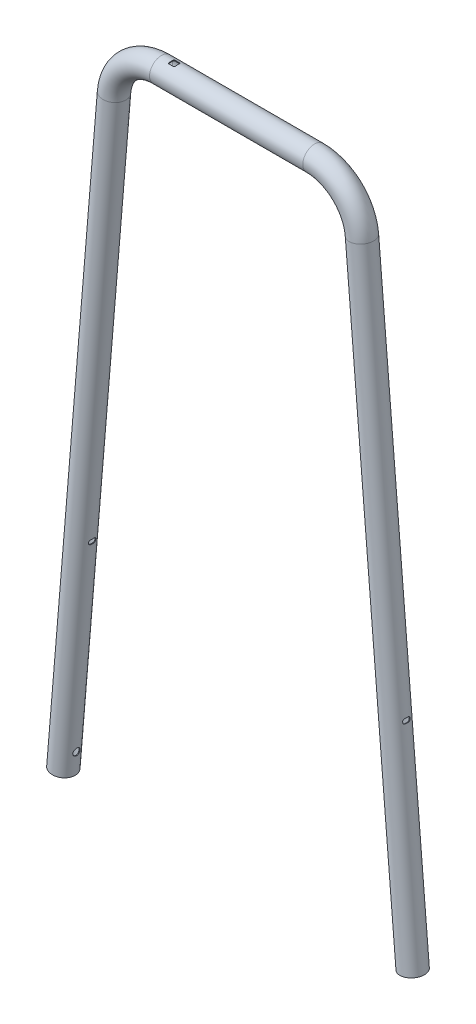
from build123d import *

# Parameters (mm, degrees)
SKETCH2_R           = 13.2
SKETCH2_R_2         = 12.4
SKETCH17_R          = 4
CUT_EXTRUDE6_DEPTH  = 50
CUT_EXTRUDE7_DEPTH  = 50
SKETCH19_R          = 4
CUT_EXTRUDE8_DEPTH  = 50
SKETCH20_R          = 3.5
CUT_EXTRUDE9_DEPTH  = 50
CUT_EXTRUDE10_DEPTH = 10


with BuildPart() as part:
    # Sweep2: sweep along a path in Sketch1
    with BuildLine(Plane.XY) as sweep2_path:
        Line((194.85, -162.284032228), (138.289119497, 518.40480277))
        ThreePointArc((138.289119497, 518.40480277), (121.362593539, 553.013456504), (85.471147865, 567.015967772))
        Line((85.471147865, 567.015967772), (-85.471147865, 567.015967772))
        ThreePointArc((-85.471147865, 567.015967772), (-121.362593539, 553.013456504), (-138.289119497, 518.40480277))
        Line((-138.289119497, 518.40480277), (-194.85, -162.284032228))
    # Sketch2 → Sweep2 (sweep)
    with BuildSketch(Plane(origin=(-194.85, -162.284032228, 0), x_dir=(-0.9965655024977618, 0.08280820751220104, 0), z_dir=(-0.08280820751220103, -0.9965655024977617, 0))):
        Circle(SKETCH2_R)
        Circle(SKETCH2_R_2, mode=Mode.SUBTRACT)
    sweep(path=sweep2_path.line)

    # Sketch17 → Cut-Extrude6 (cut)
    with BuildSketch(Plane(origin=(-194.85, -162.284032228, 0), x_dir=(0, 0, 1), z_dir=(-0.9965655024977617, 0.08280820751220212, 0))):
        with Locations((0, 23.8)):
            Circle(SKETCH17_R)
    cut_extrude6 = extrude(amount=-CUT_EXTRUDE6_DEPTH, mode=Mode.SUBTRACT)

    # Sketch18 → Cut-Extrude7 (cut, symmetric)
    with BuildSketch(Plane(origin=(-194.85, -162.284032228, 0), x_dir=(0, 0, 1), z_dir=(-0.9965655024977617, 0.08280820751220212, 0))):
        with BuildLine():
            Line((-2, 239.3), (2, 239.3))
            ThreePointArc((2, 239.3), (3.414213562, 238.714213562), (4, 237.3))
            Line((4, 237.3), (4, 236.3))
            ThreePointArc((4, 236.3), (3.414213562, 234.885786438), (2, 234.3))
            Line((2, 234.3), (-2, 234.3))
            ThreePointArc((-2, 234.3), (-3.414213562, 234.885786438), (-4, 236.3))
            Line((-4, 236.3), (-4, 237.3))
            ThreePointArc((-4, 237.3), (-3.414213562, 238.714213562), (-2, 239.3))
        make_face()
    cut_extrude7 = extrude(amount=CUT_EXTRUDE7_DEPTH, both=True, mode=Mode.SUBTRACT)

    # Mirror2: Cut-Extrude6, Cut-Extrude7 across plane
    add(cut_extrude6.mirror(Plane(origin=(0, 0, 0), x_dir=(0, 0, 1), z_dir=(1, 0, 0))), mode=Mode.SUBTRACT)
    add(cut_extrude7.mirror(Plane(origin=(0, 0, 0), x_dir=(0, 0, 1), z_dir=(1, 0, 0))), mode=Mode.SUBTRACT)

    # Sketch19 → Cut-Extrude8 (cut)
    with BuildSketch(Plane(origin=(-194.85, -162.284032228, 0), x_dir=(0, 0, 1), z_dir=(-0.9965655024977617, 0.08280820751220212, 0))):
        with Locations((0, 496.8)):
            Circle(SKETCH19_R)
    extrude(amount=CUT_EXTRUDE8_DEPTH, mode=Mode.SUBTRACT)

    # Sketch20 → Cut-Extrude9 (cut)
    with BuildSketch(Plane(origin=(0, 580.215967772, 0), x_dir=(1, 0, 0), z_dir=(0, 1, 0))):
        with Locations((-70.989119497, 0)):
            Circle(SKETCH20_R)
    extrude(amount=-CUT_EXTRUDE9_DEPTH, mode=Mode.SUBTRACT)

    # Sketch21 → Cut-Extrude10 (cut)
    with BuildSketch(Plane(origin=(0, 580.215967772, 0), x_dir=(1, 0, 0), z_dir=(0, 1, 0))):
        with BuildLine():
            Line((-73.489119497, -3.5), (-68.489119497, -3.5))
            ThreePointArc((-68.489119497, -3.5), (-67.782012716, -3.207106781), (-67.489119497, -2.5))
            Line((-67.489119497, -2.5), (-67.489119497, 2.5))
            ThreePointArc((-67.489119497, 2.5), (-67.782012716, 3.207106781), (-68.489119497, 3.5))
            Line((-68.489119497, 3.5), (-73.489119497, 3.5))
            ThreePointArc((-73.489119497, 3.5), (-74.196226279, 3.207106781), (-74.489119497, 2.5))
            Line((-74.489119497, 2.5), (-74.489119497, -2.5))
            ThreePointArc((-74.489119497, -2.5), (-74.196226279, -3.207106781), (-73.489119497, -3.5))
        make_face()
    extrude(amount=-CUT_EXTRUDE10_DEPTH, mode=Mode.SUBTRACT)


solid = part.part
